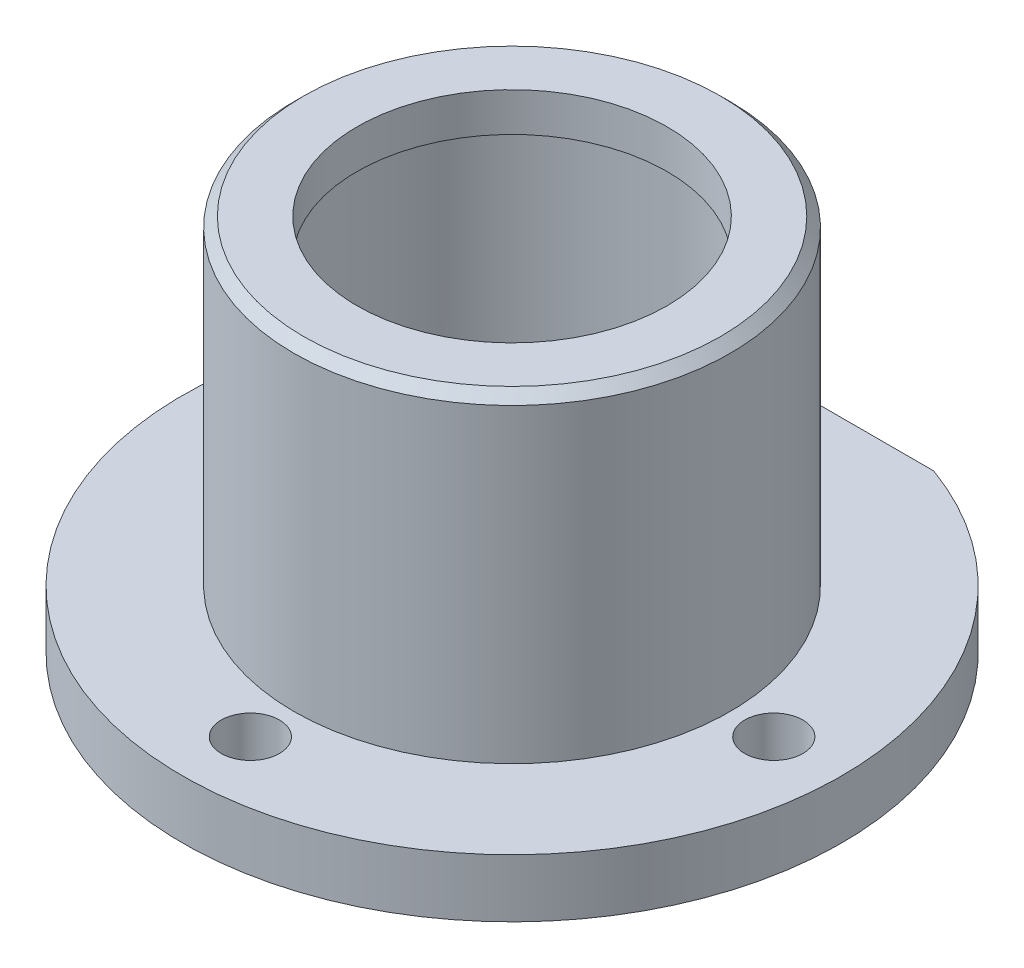
from build123d import *

# Parameters (mm, degrees)
SKETCH_1_R      = 3
EXTRUDE_1_DEPTH = 6
SKETCH_2_R      = 22.5
EXTRUDE_2_DEPTH = 33
CHAMFER_1_SIZE  = 1


with BuildPart() as part:
    # 草图1 → 凸台-拉伸1 (new body)
    with BuildSketch(Plane(origin=(0, 0, 0), x_dir=(1, 0, 0), z_dir=(0, 1, 0))):
        with BuildLine():
            Line((11.489125293, 32), (-11.489125293, 32))
            ThreePointArc((-11.489125293, 32), (0, -34), (11.489125293, 32))
        make_face()
        with Locations(Location((0, 27, 0), (0, 0, 270))):
            Circle(SKETCH_1_R, mode=Mode.SUBTRACT)
        with Locations(Location((27, 0, 0), (0, 0, 270))):
            Circle(SKETCH_1_R, mode=Mode.SUBTRACT)
        with Locations(Location((0, -27, 0), (0, 0, 270))):
            Circle(SKETCH_1_R, mode=Mode.SUBTRACT)
        with Locations(Location((-27, 0, 0), (0, 0, 270))):
            Circle(SKETCH_1_R, mode=Mode.SUBTRACT)
    extrude(amount=EXTRUDE_1_DEPTH)

    # 草图2 → 凸台-拉伸2 (add)
    with BuildSketch(Plane(origin=(0, 6, 0), x_dir=(1, 0, 0), z_dir=(0, 1, 0))):
        with Locations(Location((0, 0, 0), (0, 0, 270))):
            Circle(SKETCH_2_R)
    extrude(amount=EXTRUDE_2_DEPTH)

    # 草图3 → 切除-旋转1 (revolve, cut)
    with BuildSketch(Plane.XY):
        Polygon((0, 39), (16, 39), (16, 35), (18.5, 35), (18.5, 0), (0, 0), align=None)
    revolve(axis=Axis((0, 0, 0), (0, 1, 0)), mode=Mode.SUBTRACT)

    # 倒角1
    chamfer_1_edges = [part.edges().sort_by_distance(p)[0] for p in [
        (0, 39, -22.5),
        (-18.5, 0, 0),
    ]]
    chamfer(chamfer_1_edges, length=CHAMFER_1_SIZE)


solid = part.part
